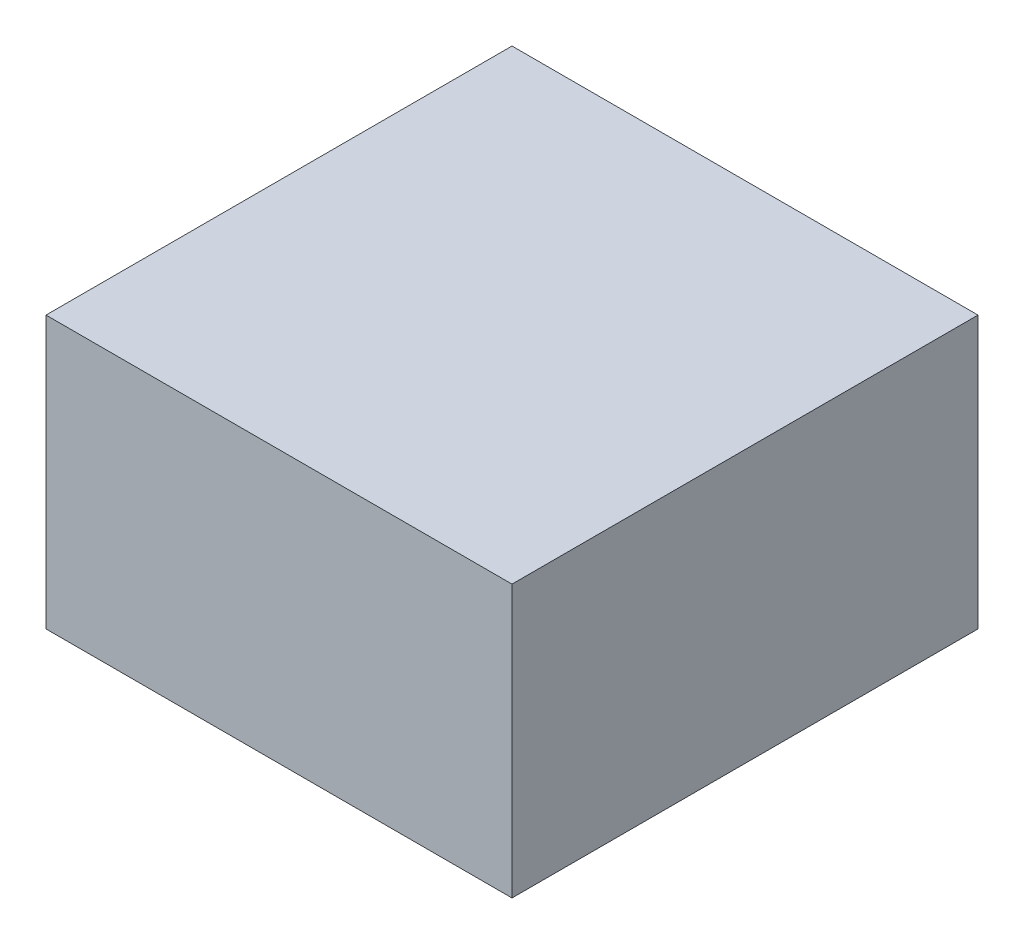
from build123d import *

# Parameters (mm, degrees)
SKETCH2_W           = 60
SKETCH2_H           = 60
BOSS_EXTRUDE1_DEPTH = 35


with BuildPart() as part:
    # Sketch2 → Boss-Extrude1 (new body)
    with BuildSketch(Plane(origin=(0, 0, 0), x_dir=(1, 0, 0), z_dir=(0, 1, 0))):
        Rectangle(SKETCH2_W, SKETCH2_H)
    extrude(amount=BOSS_EXTRUDE1_DEPTH)


solid = part.part
